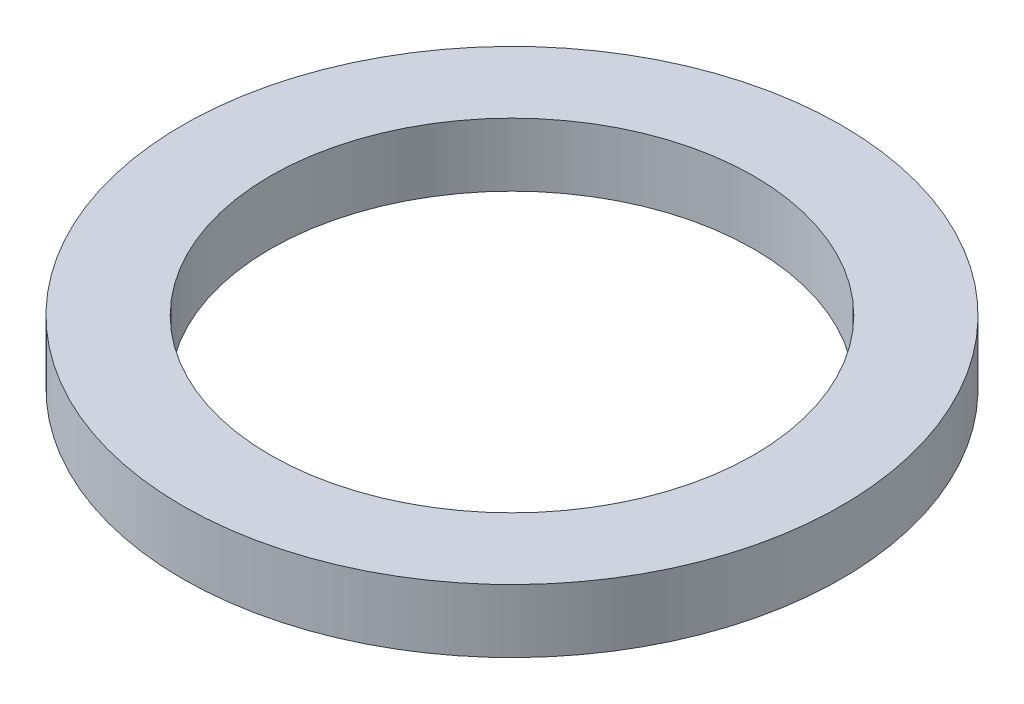
from build123d import *

# Parameters (mm, degrees)
IZIM1_R                     = 10.84
Y_KSEKLIK_EKSTR_ZYON1_DEPTH = 2.08
KES_EKSTR_ZYON1_DEPTH       = 2
KES_EKSTR_ZYON1_DEPTH_BACK  = 3.08
IZIM2_R                     = 7.95


with BuildPart() as part:
    # Çizim1 → Yükseklik-Ekstrüzyon1 (new body)
    with BuildSketch(Plane(origin=(0, 0, 0), x_dir=(1, 0, 0), z_dir=(0, 1, 0))):
        with Locations(Location((0, 0, 0), (0, 0, 270))):
            Circle(IZIM1_R)
    extrude(amount=Y_KSEKLIK_EKSTR_ZYON1_DEPTH)

    # Çizim2 → Kes-Ekstrüzyon1 (cut, two sides: drawn at the far end of the back side and taken through both)
    with BuildSketch(Plane(origin=(0, 2.08, 0), x_dir=(1, 0, 0), z_dir=(0, 1, 0)).offset(-KES_EKSTR_ZYON1_DEPTH_BACK)):
        with Locations(Location((0, 0, 0), (0, 0, 270))):
            Circle(IZIM2_R)
    extrude(amount=KES_EKSTR_ZYON1_DEPTH + KES_EKSTR_ZYON1_DEPTH_BACK, mode=Mode.SUBTRACT)


solid = part.part
